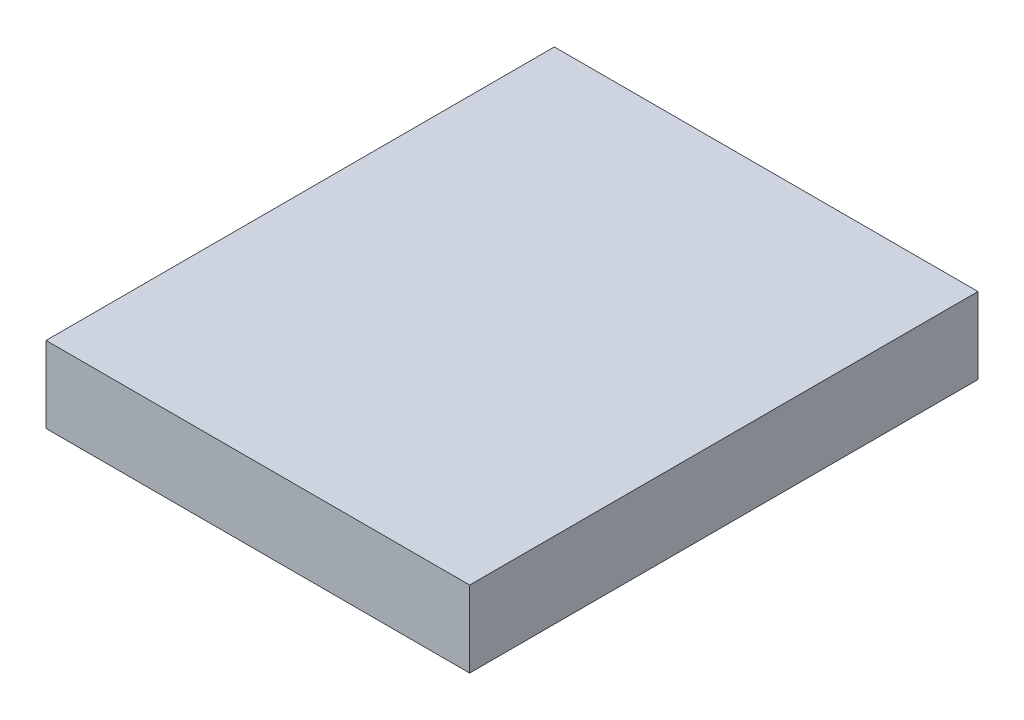
from build123d import *

# Parameters (mm, degrees)
SKETCH1_W           = 25
SKETCH1_H           = 30
BOSS_EXTRUDE1_DEPTH = 4.5


with BuildPart() as part:
    # Sketch1 → Boss-Extrude1 (new body)
    with BuildSketch(Plane(origin=(0, 0, 0), x_dir=(1, 0, 0), z_dir=(0, 1, 0))):
        Rectangle(SKETCH1_W, SKETCH1_H)
    extrude(amount=BOSS_EXTRUDE1_DEPTH)


solid = part.part
